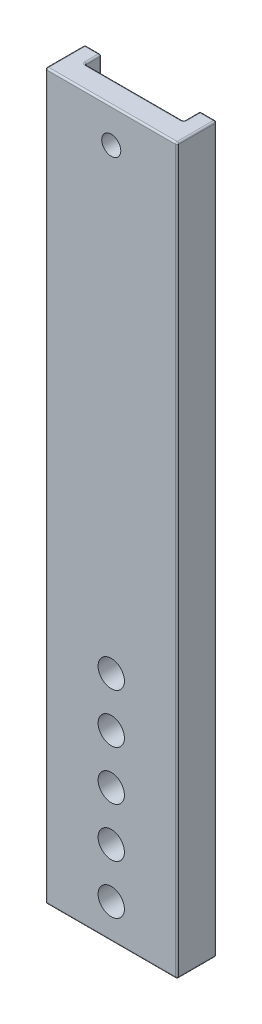
from build123d import *

# Parameters (mm, degrees)
SALIENTE_EXTRUIR1_DEPTH = 40
REDONDEO1_R             = 0.5
CROQUIS5_W              = 30
CROQUIS5_H              = 220
CORTAR_EXTRUIR2_DEPTH   = 5
CORTAR_EXTRUIR3_REACH   = 211.557
CROQUIS6_R              = 4
CROQUIS6_R_2            = 2.9
REDONDEO2_R             = 0.5


with BuildPart() as part:
    # Croquis2 → Saliente-Extruir1 (new body)
    with BuildSketch(Plane(origin=(0, 0, 0), x_dir=(0, 0, -1), z_dir=(1, 0, 0))):
        Polygon((-24.94884824, -14.646248332), (-12.94884824, -14.646248332), (-12.94884824, -5.646248332), (-12.94884824, 205.353751668), (-24.94884824, 205.353751668), align=None)
    extrude(amount=SALIENTE_EXTRUIR1_DEPTH)

    # Redondeo1
    redondeo1_edges = [part.edges().sort_by_distance(p)[0] for p in [
        (40, 95.353751668, 12.94884824),
        (40, 205.353751668, 18.94884824),
        (40, 95.353751668, 24.94884824),
        (0, 205.353751668, 18.94884824),
        (0, 95.353751668, 12.94884824),
        (0, -14.646248332, 18.94884824),
        (0, 95.353751668, 24.94884824),
        (40, -14.646248332, 18.94884824),
        (20, 205.353751668, 24.94884824),
        (20, 205.353751668, 12.94884824),
        (20, -14.646248332, 12.94884824),
        (20, -14.646248332, 24.94884824),
    ]]
    fillet(redondeo1_edges, radius=REDONDEO1_R)

    # Croquis5 → Cortar-Extruir2 (cut)
    with BuildSketch(Plane.XY.offset(12.94884824)):
        with Locations((20, 95.353751668)):
            Rectangle(CROQUIS5_W, CROQUIS5_H)
    extrude(amount=CORTAR_EXTRUIR2_DEPTH, mode=Mode.SUBTRACT)

    # Croquis6 → Cortar-Extruir3 (cut, up to next)
    with BuildSketch(Plane.XY.offset(24.94884824), mode=Mode.PRIVATE) as cortar_extruir3_sk1:
        with Locations((20, -4.146248332)):
            Circle(CROQUIS6_R)
    cortar_extruir3_tool1 = extrude(cortar_extruir3_sk1.sketch, amount=-CORTAR_EXTRUIR3_REACH, mode=Mode.PRIVATE) & part.part
    # Croquis6 → Cortar-Extruir3 (cut, up to next)
    with BuildSketch(Plane.XY.offset(24.94884824), mode=Mode.PRIVATE) as cortar_extruir3_sk2:
        with Locations((20, 194.853751668)):
            Circle(CROQUIS6_R_2)
    cortar_extruir3_tool2 = extrude(cortar_extruir3_sk2.sketch, amount=-CORTAR_EXTRUIR3_REACH, mode=Mode.PRIVATE) & part.part
    # Croquis6 → Cortar-Extruir3 (cut, up to next)
    with BuildSketch(Plane.XY.offset(24.94884824), mode=Mode.PRIVATE) as cortar_extruir3_sk3:
        with Locations((20, 10.853751668)):
            Circle(CROQUIS6_R)
    cortar_extruir3_tool3 = extrude(cortar_extruir3_sk3.sketch, amount=-CORTAR_EXTRUIR3_REACH, mode=Mode.PRIVATE) & part.part
    # Croquis6 → Cortar-Extruir3 (cut, up to next)
    with BuildSketch(Plane.XY.offset(24.94884824), mode=Mode.PRIVATE) as cortar_extruir3_sk4:
        with Locations((20, 25.853751668)):
            Circle(CROQUIS6_R)
    cortar_extruir3_tool4 = extrude(cortar_extruir3_sk4.sketch, amount=-CORTAR_EXTRUIR3_REACH, mode=Mode.PRIVATE) & part.part
    # Croquis6 → Cortar-Extruir3 (cut, up to next)
    with BuildSketch(Plane.XY.offset(24.94884824), mode=Mode.PRIVATE) as cortar_extruir3_sk5:
        with Locations((20, 40.853751668)):
            Circle(CROQUIS6_R)
    cortar_extruir3_tool5 = extrude(cortar_extruir3_sk5.sketch, amount=-CORTAR_EXTRUIR3_REACH, mode=Mode.PRIVATE) & part.part
    # Croquis6 → Cortar-Extruir3 (cut, up to next)
    with BuildSketch(Plane.XY.offset(24.94884824), mode=Mode.PRIVATE) as cortar_extruir3_sk6:
        with Locations((20, 55.853751668)):
            Circle(CROQUIS6_R)
    cortar_extruir3_tool6 = extrude(cortar_extruir3_sk6.sketch, amount=-CORTAR_EXTRUIR3_REACH, mode=Mode.PRIVATE) & part.part
    add(cortar_extruir3_tool1.solids().sort_by_distance((20, -4.146248, 24.948848))[0], mode=Mode.SUBTRACT)
    add(cortar_extruir3_tool2.solids().sort_by_distance((20, 194.853752, 24.948848))[0], mode=Mode.SUBTRACT)
    add(cortar_extruir3_tool3.solids().sort_by_distance((20, 10.853752, 24.948848))[0], mode=Mode.SUBTRACT)
    add(cortar_extruir3_tool4.solids().sort_by_distance((20, 25.853752, 24.948848))[0], mode=Mode.SUBTRACT)
    add(cortar_extruir3_tool5.solids().sort_by_distance((20, 40.853752, 24.948848))[0], mode=Mode.SUBTRACT)
    add(cortar_extruir3_tool6.solids().sort_by_distance((20, 55.853752, 24.948848))[0], mode=Mode.SUBTRACT)

    # Redondeo2
    redondeo2_edges = [part.edges().sort_by_distance(p)[0] for p in [
        (35, 205.207305058, 13.095294849),
        (5, 205.207305058, 13.095294849),
        (35, 205.353751668, 15.69884824),
        (5, 95.353751668, 12.94884824),
        (5, -14.499801723, 13.095294849),
        (5, 205.353751668, 15.69884824),
        (5, -14.646248332, 15.69884824),
        (35, -14.646248332, 15.69884824),
        (35, -14.499801723, 13.095294849),
        (35, 95.353751668, 12.94884824),
        (5, 95.353751668, 17.94884824),
        (20, -14.646248332, 17.94884824),
        (35, 95.353751668, 17.94884824),
        (20, 205.353751668, 17.94884824),
    ]]
    fillet(redondeo2_edges, radius=REDONDEO2_R)


solid = part.part
